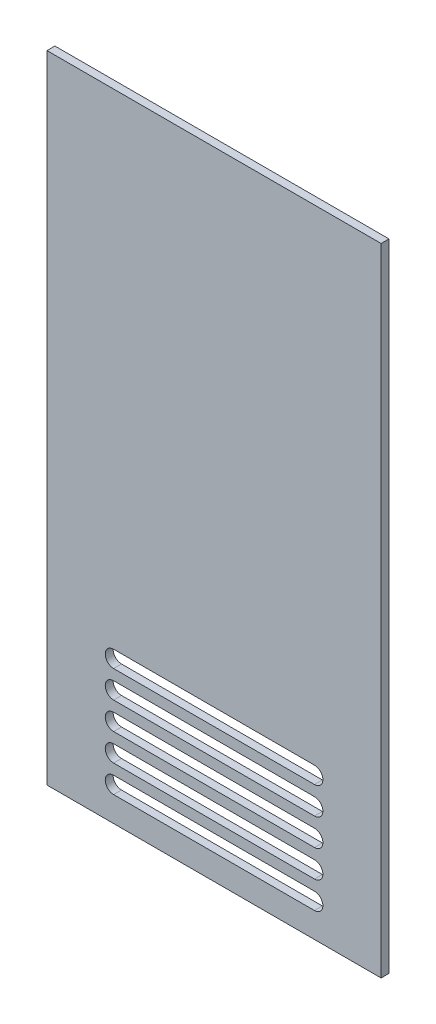
from build123d import *

# Parameters (mm, degrees)
SKETCH1_W           = 126.746
SKETCH1_H           = 241.3
BOSS_EXTRUDE1_DEPTH = 2.9972
CUT_EXTRUDE1_DEPTH  = 137.314132931


with BuildPart() as part:
    # Sketch1 → Boss-Extrude1 (new body)
    with BuildSketch(Plane.XY):
        Rectangle(SKETCH1_W, SKETCH1_H)
    extrude(amount=BOSS_EXTRUDE1_DEPTH)

    # Sketch2 → Cut-Extrude1 (cut, through all)
    with BuildSketch(Plane.XY.offset(2.9972)):
        with BuildLine():
            Line((-38.1, -63.375), (38.1, -63.375))
            ThreePointArc((38.1, -63.375), (41.275, -66.55), (38.1, -69.725))
            Line((38.1, -69.725), (-38.1, -69.725))
            ThreePointArc((-38.1, -69.725), (-41.275, -66.55), (-38.1, -63.375))
        make_face()
        with BuildLine():
            Line((-38.1, -84.075), (38.1, -84.075))
            ThreePointArc((38.1, -84.075), (41.275, -87.25), (38.1, -90.425))
            Line((38.1, -90.425), (-38.1, -90.425))
            ThreePointArc((-38.1, -90.425), (-41.275, -87.25), (-38.1, -84.075))
        make_face()
        with BuildLine():
            Line((-38.1, -104.775), (38.1, -104.775))
            ThreePointArc((38.1, -104.775), (41.275, -107.95), (38.1, -111.125))
            Line((38.1, -111.125), (-38.1, -111.125))
            ThreePointArc((-38.1, -111.125), (-41.275, -107.95), (-38.1, -104.775))
        make_face()
        with BuildLine():
            Line((-38.1, -73.725), (38.1, -73.725))
            ThreePointArc((38.1, -73.725), (41.275, -76.9), (38.1, -80.075))
            Line((38.1, -80.075), (-38.1, -80.075))
            ThreePointArc((-38.1, -80.075), (-41.275, -76.9), (-38.1, -73.725))
        make_face()
        with BuildLine():
            Line((-38.1, -94.425), (38.1, -94.425))
            ThreePointArc((38.1, -94.425), (41.275, -97.6), (38.1, -100.775))
            Line((38.1, -100.775), (-38.1, -100.775))
            ThreePointArc((-38.1, -100.775), (-41.275, -97.6), (-38.1, -94.425))
        make_face()
    extrude(amount=-CUT_EXTRUDE1_DEPTH, mode=Mode.SUBTRACT)


solid = part.part
